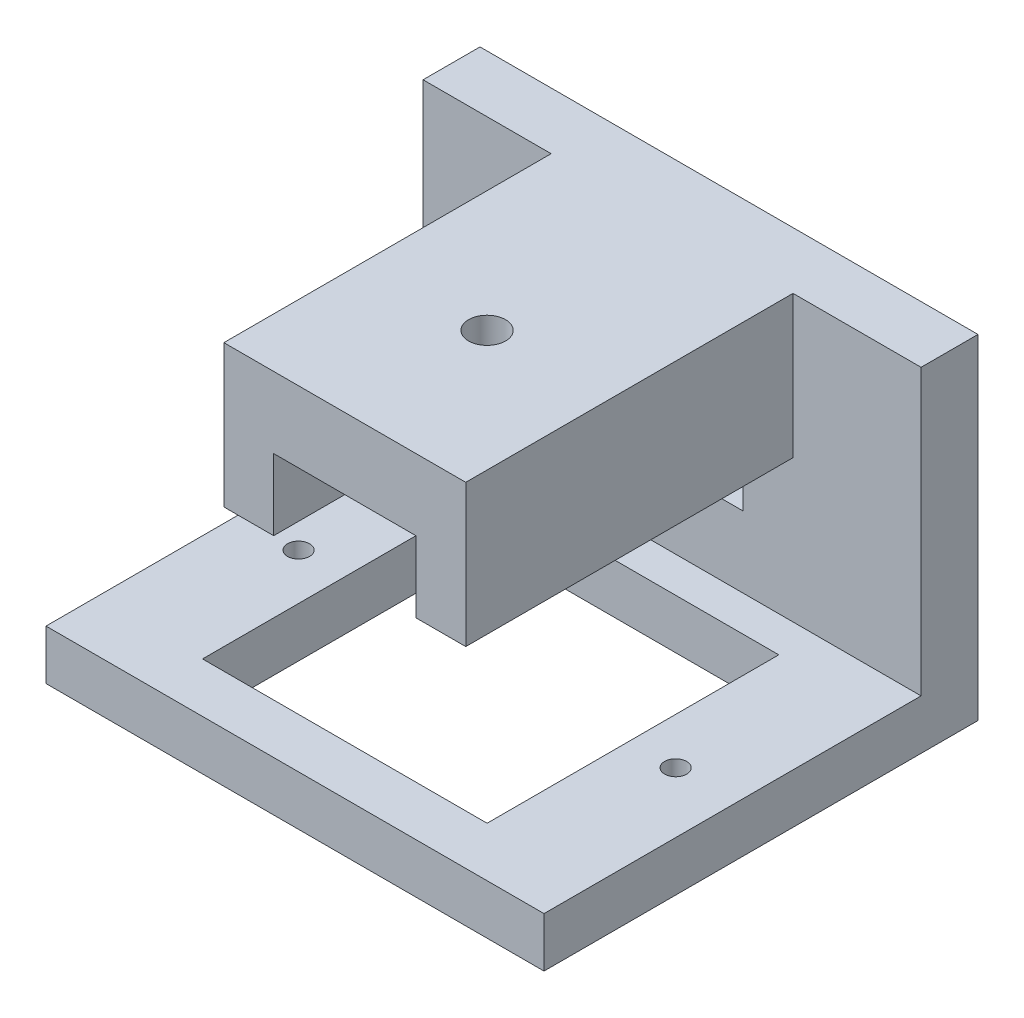
from build123d import *

# Parameters (mm, degrees)
BOSS_EXTRUDE1_DEPTH = 7
SKETCH4_R           = 1.55
CUT_EXTRUDE1_DEPTH  = 89.684835231
SKETCH5_W           = 70
SKETCH5_H           = 8
BOSS_EXTRUDE2_DEPTH = 40
SKETCH6_W           = 20
SKETCH6_H           = 20
CUT_EXTRUDE2_DEPTH  = 101.124921973
BOSS_EXTRUDE4_DEPTH = 46
SKETCH9_R           = 2.6
CUT_EXTRUDE3_DEPTH  = 101.124921973
SKETCH10_W          = 70
SKETCH10_H          = 7
BOSS_EXTRUDE5_DEPTH = 7


with BuildPart() as part:
    # Sketch1 → Boss-Extrude1 (new body)
    with BuildSketch(Plane(origin=(0, 0, 0), x_dir=(1, 0, 0), z_dir=(0, 1, 0))):
        Polygon((0, 54), (0, 0), (15, 0), (15, 41), (55, 41), (55, 0), (70, 0), (70, 54), align=None)
    extrude(amount=BOSS_EXTRUDE1_DEPTH)

    # Sketch4 → Cut-Extrude1 (cut, through all)
    with BuildSketch(Plane(origin=(0, 7, 0), x_dir=(1, 0, 0), z_dir=(0, 1, 0))):
        with Locations(Location((8.5, 20, 0), (0, 0, 270))):
            Circle(SKETCH4_R)
        with Locations(Location((61.5, 20, 0), (0, 0, 270))):
            Circle(SKETCH4_R)
    extrude(amount=-CUT_EXTRUDE1_DEPTH, mode=Mode.SUBTRACT)

    # Sketch5 → Boss-Extrude2 (add)
    with BuildSketch(Plane(origin=(0, 7, 0), x_dir=(1, 0, 0), z_dir=(0, 1, 0))):
        with Locations((35, 50)):
            Rectangle(SKETCH5_W, SKETCH5_H)
    extrude(amount=BOSS_EXTRUDE2_DEPTH)

    # Sketch6 → Cut-Extrude2 (cut, through all)
    with BuildSketch(Plane(origin=(0, 0, -54), x_dir=(-1, 0, 0), z_dir=(0, 0, -1))):
        with Locations((-35, 27)):
            Rectangle(SKETCH6_W, SKETCH6_H)
    extrude(amount=-CUT_EXTRUDE2_DEPTH, mode=Mode.SUBTRACT)

    # Sketch8 → Boss-Extrude4 (add)
    with BuildSketch(Plane.XY.offset(-46)):
        Polygon((18, 47), (52, 47), (52, 27), (45, 27), (45, 37), (25, 37), (25, 27), (18, 27), align=None)
    extrude(amount=BOSS_EXTRUDE4_DEPTH)

    # Sketch9 → Cut-Extrude3 (cut, through all)
    with BuildSketch(Plane(origin=(0, 47, 0), x_dir=(1, 0, 0), z_dir=(0, 1, 0))):
        with Locations(Location((35, 20, 0), (0, 0, 270))):
            Circle(SKETCH9_R)
    extrude(amount=-CUT_EXTRUDE3_DEPTH, mode=Mode.SUBTRACT)

    # Sketch10 → Boss-Extrude5 (add)
    with BuildSketch(Plane.XY):
        with Locations((35, 3.5)):
            Rectangle(SKETCH10_W, SKETCH10_H)
    extrude(amount=BOSS_EXTRUDE5_DEPTH)


solid = part.part
